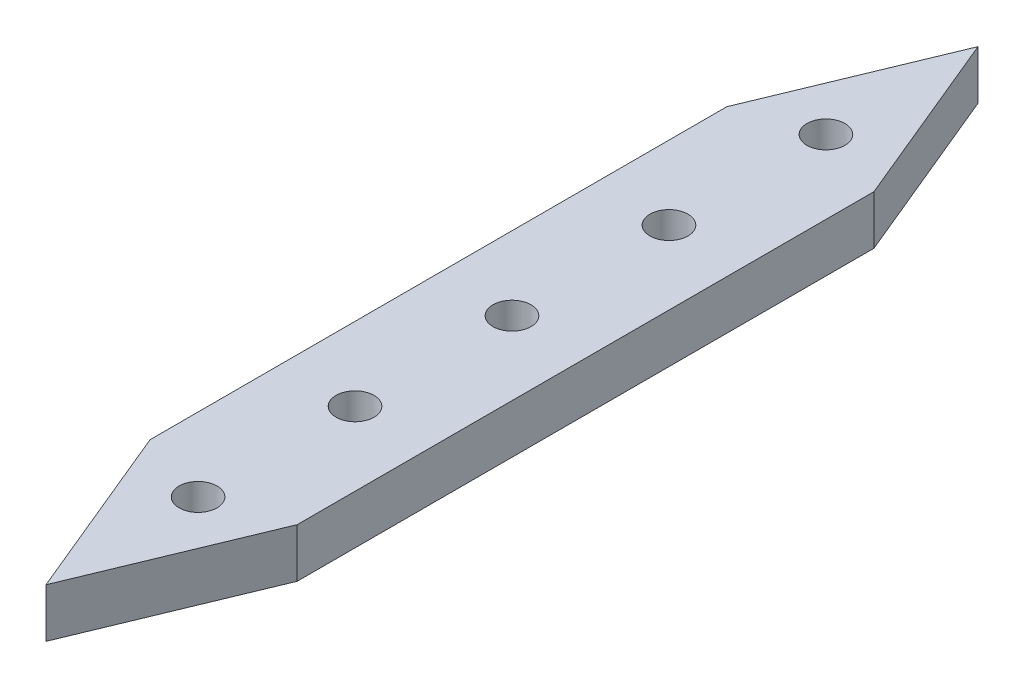
from build123d import *

# Parameters (mm, degrees)
BOSS_EXTRUDE1_DEPTH          = 6.35
F_10_0_1935_DIAMETER_HOLE1_D = 4.9149


with BuildPart() as part:
    # Sketch1 → Boss-Extrude1 (new body)
    with BuildSketch(Plane(origin=(0, 0, 0), x_dir=(1, 0, 0), z_dir=(0, 1, 0))):
        Polygon((0, 60.325), (-9.525, 37.329615818), (-9.525, -37.329615818), (0, -60.325), (9.525, -37.329615818), (9.525, 37.329615818), align=None)
    extrude(amount=BOSS_EXTRUDE1_DEPTH)

    # #10 (0.1935) Diameter Hole1 (through all)
    with Locations(Plane(origin=(0, 6.35, 0), x_dir=(1, 0, 0), z_dir=(0, 1, 0))):
        with Locations((0, 20.32), (0, 40.64), (0, 0), (0, -20.32), (0, -40.64)):
            Hole(F_10_0_1935_DIAMETER_HOLE1_D / 2)


solid = part.part
